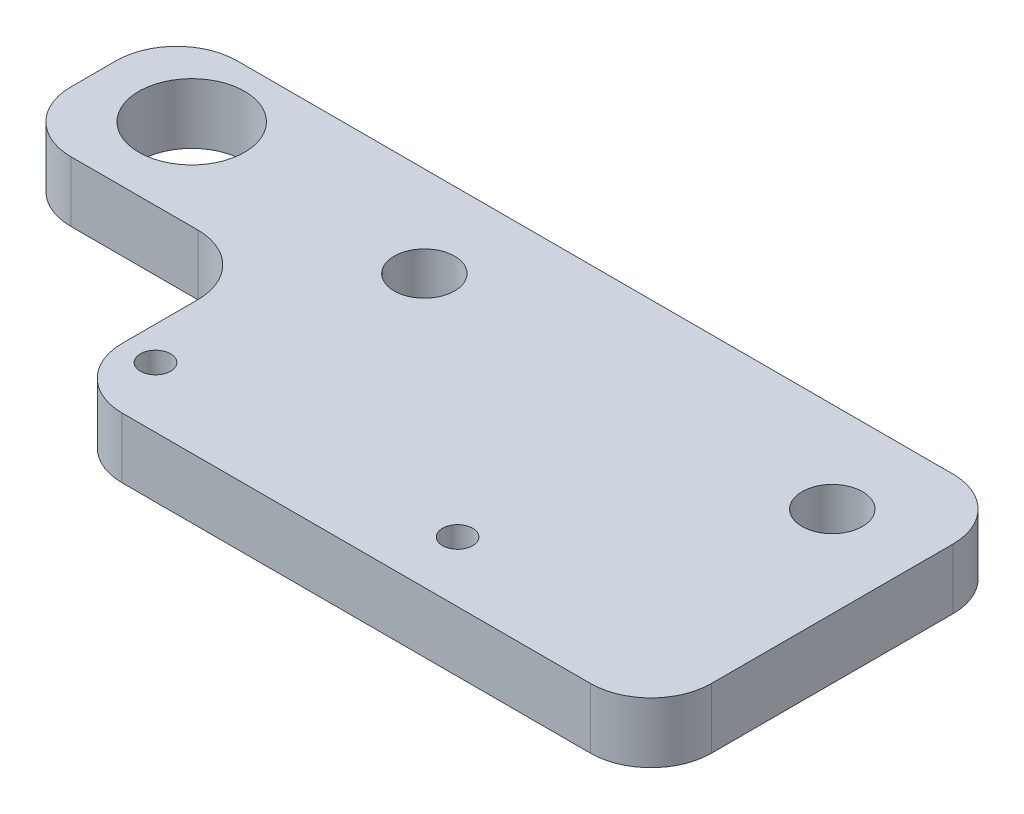
from build123d import *

# Parameters (mm, degrees)
SKETCH1_R           = 1
SKETCH1_R_2         = 0.5
SKETCH1_R_3         = 1.75
BOSS_EXTRUDE1_DEPTH = 2
FILLET1_R           = 2


with BuildPart() as part:
    # Sketch1 → Boss-Extrude1 (new body)
    with BuildSketch(Plane(origin=(0, 0, 0), x_dir=(1, 0, 0), z_dir=(0, 1, 0))):
        Polygon((-12.864326531, 1.102455199), (6.635673469, 1.102455199), (6.635673469, -10.897544801), (-12.864326531, -10.897544801), (-12.864326531, -4.397544801), (-21.064326531, -4.397544801), (-21.064326531, 1.102455199), align=None)
        with Locations(Location((-9.864326531, -1.897544801, 0), (0, 0, 270))):
            Circle(SKETCH1_R, mode=Mode.SUBTRACT)
        with Locations(Location((3.635673469, -1.897544801, 0), (0, 0, 270))):
            Circle(SKETCH1_R, mode=Mode.SUBTRACT)
        with Locations(Location((-11.764326531, -8.897544801, 0), (0, 0, 270))):
            Circle(SKETCH1_R_2, mode=Mode.SUBTRACT)
        with Locations(Location((-1.764326531, -8.897544801, 0), (0, 0, 270))):
            Circle(SKETCH1_R_2, mode=Mode.SUBTRACT)
        with Locations(Location((-18.064326531, -1.397544801, 0), (0, 0, 270))):
            Circle(SKETCH1_R_3, mode=Mode.SUBTRACT)
    extrude(amount=BOSS_EXTRUDE1_DEPTH)

    # Fillet1
    fillet1_edges = [part.edges().sort_by_distance(p)[0] for p in [
        (6.635673469, 1, -1.102455199),
        (6.635673469, 1, 10.897544801),
        (-12.864326531, 1, 10.897544801),
        (-12.864326531, 1, 4.397544801),
        (-21.064326531, 1, 4.397544801),
        (-21.064326531, 1, -1.102455199),
    ]]
    fillet(fillet1_edges, radius=FILLET1_R)


solid = part.part
